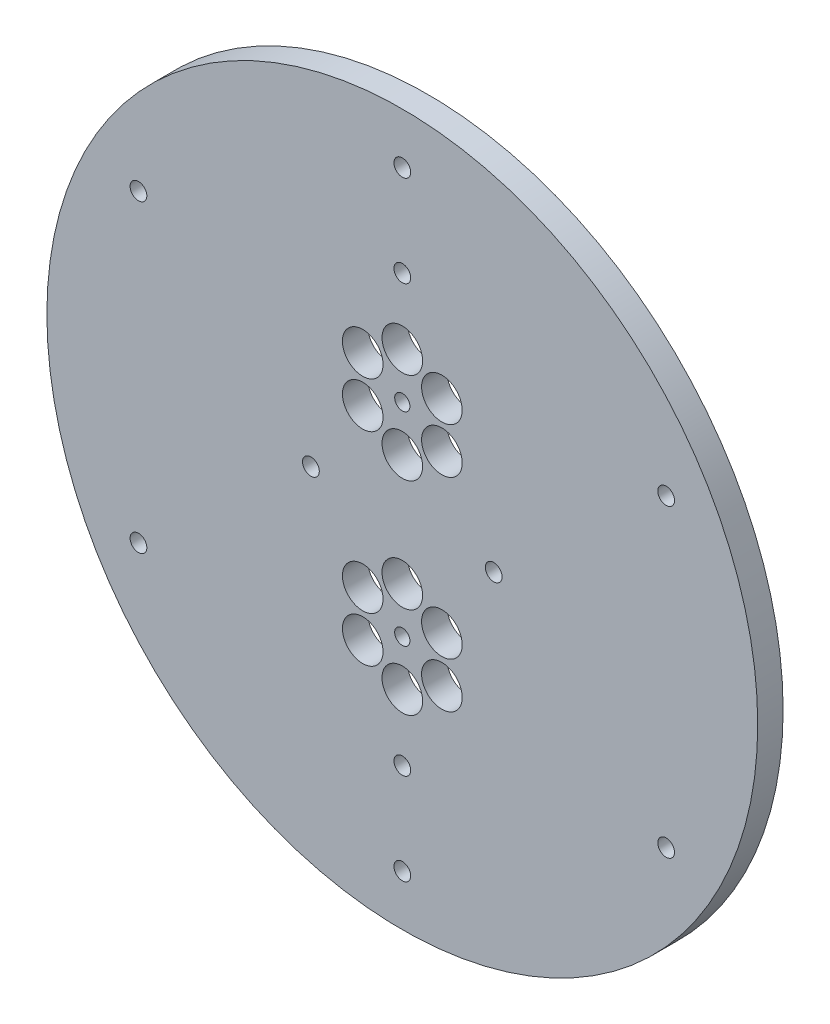
from build123d import *

# Parameters (mm, degrees)
SKETCH1_R           = 70
SKETCH1_R_2         = 1.65
SKETCH1_R_3         = 4
SKETCH1_R_4         = 1.5
BOSS_EXTRUDE1_DEPTH = 5
SKETCH2_R           = 1.65
CUT_EXTRUDE1_DEPTH  = 100.121138008


with BuildPart() as part:
    # Sketch1 → Boss-Extrude1 (new body)
    with BuildSketch(Plane.XY):
        Circle(SKETCH1_R)
        with Locations((0, 60)):
            Circle(SKETCH1_R_2, mode=Mode.SUBTRACT)
        with Locations((51.961524227, 30)):
            Circle(SKETCH1_R_2, mode=Mode.SUBTRACT)
        with Locations((51.961524227, -30)):
            Circle(SKETCH1_R_2, mode=Mode.SUBTRACT)
        with Locations((0, -60)):
            Circle(SKETCH1_R_2, mode=Mode.SUBTRACT)
        with Locations((-51.961524227, -30)):
            Circle(SKETCH1_R_2, mode=Mode.SUBTRACT)
        with Locations((-51.961524227, 30)):
            Circle(SKETCH1_R_2, mode=Mode.SUBTRACT)
        with Locations((0, 29)):
            Circle(SKETCH1_R_3, mode=Mode.SUBTRACT)
        with Locations((7.794228634, 24.5)):
            Circle(SKETCH1_R_3, mode=Mode.SUBTRACT)
        with Locations((7.794228634, 15.5)):
            Circle(SKETCH1_R_3, mode=Mode.SUBTRACT)
        with Locations((0, 11)):
            Circle(SKETCH1_R_3, mode=Mode.SUBTRACT)
        with Locations((-7.794228634, 15.5)):
            Circle(SKETCH1_R_3, mode=Mode.SUBTRACT)
        with Locations((-7.794228634, 24.5)):
            Circle(SKETCH1_R_3, mode=Mode.SUBTRACT)
        with Locations((0, 20)):
            Circle(SKETCH1_R_4, mode=Mode.SUBTRACT)
        with Locations(Location((7.794228634, -15.5, 0), (0, 0, 180))):
            Circle(SKETCH1_R_3, mode=Mode.SUBTRACT)
        with Locations(Location((0, -11, 0), (0, 0, 180))):
            Circle(SKETCH1_R_3, mode=Mode.SUBTRACT)
        with Locations(Location((-7.794228634, -15.5, 0), (0, 0, 180))):
            Circle(SKETCH1_R_3, mode=Mode.SUBTRACT)
        with Locations(Location((0, -20, 0), (0, 0, 180))):
            Circle(SKETCH1_R_4, mode=Mode.SUBTRACT)
        with Locations(Location((-7.794228634, -24.5, 0), (0, 0, 180))):
            Circle(SKETCH1_R_3, mode=Mode.SUBTRACT)
        with Locations(Location((0, -29, 0), (0, 0, 180))):
            Circle(SKETCH1_R_3, mode=Mode.SUBTRACT)
        with Locations(Location((7.794228634, -24.5, 0), (0, 0, 180))):
            Circle(SKETCH1_R_3, mode=Mode.SUBTRACT)
    extrude(amount=BOSS_EXTRUDE1_DEPTH)

    # Sketch2 → Cut-Extrude1 (cut, through all)
    with BuildSketch(Plane.XY.offset(5)):
        with Locations((0, 42)):
            Circle(SKETCH2_R)
        with Locations((0, -42)):
            Circle(SKETCH2_R)
        with Locations((18, 0)):
            Circle(SKETCH2_R)
        with Locations((-18, 0)):
            Circle(SKETCH2_R)
    extrude(amount=-CUT_EXTRUDE1_DEPTH, mode=Mode.SUBTRACT)


solid = part.part
